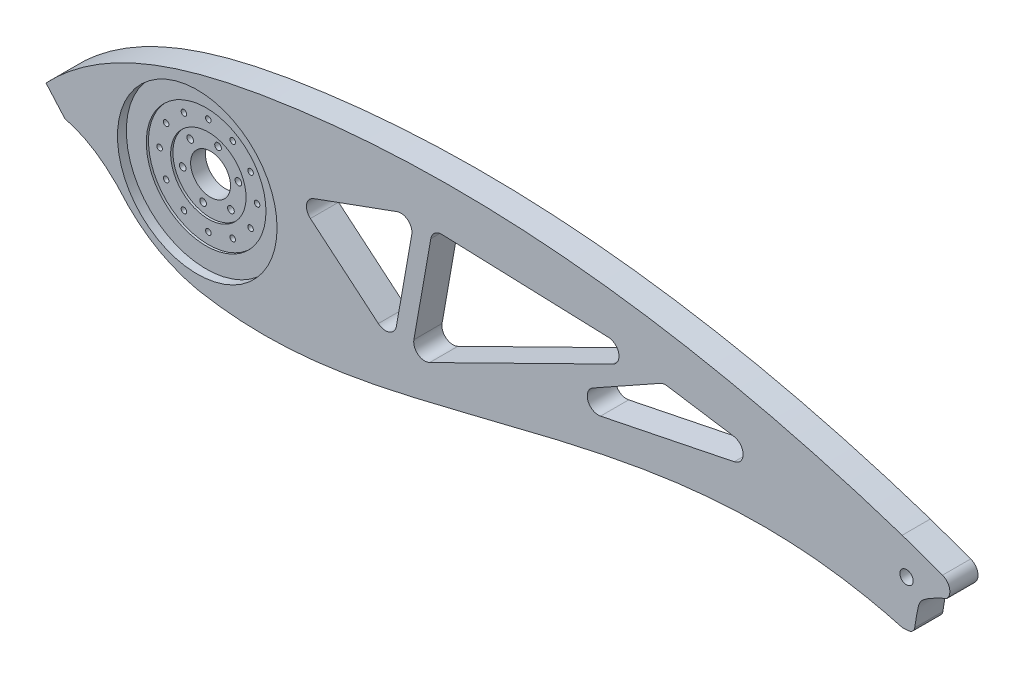
from build123d import *

# Parameters (mm, degrees)
SALIENTE_EXTRUIR1_DEPTH = 12.7
CORTAR_EXTRUIR20_DEPTH  = 62
CROQUIS12_R             = 26
CROQUIS12_R_2           = 17
CORTAR_EXTRUIR21_DEPTH  = 4
CROQUIS6_R              = 1.25
CORTAR_EXTRUIR22_DEPTH  = 29
CROQUIS13_R             = 1.5
CORTAR_EXTRUIR23_DEPTH  = 29
CROQUIS8_R              = 3
CORTAR_EXTRUIR27_DEPTH  = 64
CROQUIS5_R              = 36
CORTAR_EXTRUIR28_DEPTH  = 4
CROQUIS22_R             = 27
CORTAR_EXTRUIR32_DEPTH  = 1
CORTAR_EXTRUIR33_START  = -1
CROQUIS23_R             = 17
CORTAR_EXTRUIR33_DEPTH  = 1
CROQUIS24_R             = 9
CORTAR_EXTRUIR34_DEPTH  = 67


with BuildPart() as part:
    # Croquis2 → Saliente-Extruir1 (new body)
    with BuildSketch(Plane.XY):
        with BuildLine():
            add(Edge.make_bspline(
                [(318.003849686, 21.000507192), (228.612845689, 50.579171404), (93.837740705, 69.713331037), (-40.897656903, 33.469788637), (-68.237071347, 4.559111896)],
                knots=[0, 0, 0, 0, 0.7074371, 1, 1, 1, 1], degree=3))
            Line((-68.237071347, 4.559111896), (-59.653213383, -5.20395025))
            add(Edge.make_bspline(
                [(-31, -25), (-39.39631193, -15.138516418), (-48.385558495, -7.834552383), (-59.653213383, -5.20395025)],
                knots=[0.5325633, 0.5325633, 0.5325633, 0.5325633, 1, 1, 1, 1], degree=3))
            add(Edge.make_bspline(
                [(0, -42), (-18.317933693, -37.788499598), (-31, -25)],
                knots=[0, 0, 0, 0.892929879, 0.892929879, 0.892929879], degree=2))
            add(Edge.make_bspline(
                [(0, -42), (34.804106533, -48.583870116), (140.601557422, -28.662967351), (242.066250638, 5.979270436), (318.003849686, -15.054295763)],
                knots=[0, 0, 0, 0, 0.322299538, 1, 1, 1, 1], degree=3))
            ThreePointArc((318.003849686, -15.054295763), (319.540823222, -15.003980459), (321.071215203, -14.853250005))
            ThreePointArc((321.071215203, -14.853250005), (322.775428516, -14.025460634), (323.64375194, -12.341538815))
            add(Edge.make_bspline(
                [(338, 6.2), (337.96483394, 6.165565228), (334.391730923, 4.926696382), (325.456575586, -0.138969503), (325.231234185, -2.170240746), (323.64375194, -12.341538815)],
                knots=[0.205943753, 0.205943753, 0.205943753, 0.205943753, 0.210383616, 0.534400108, 0.959977028, 0.959977028, 0.959977028, 0.959977028], degree=3))
            ThreePointArc((338, 6.2), (339.38638351, 10.840617369), (336.189590247, 14.479010095))
            Line((336.189590247, 14.479010095), (318.003849686, 21.000507192))
        make_face()
    extrude(amount=SALIENTE_EXTRUIR1_DEPTH)

    # Croquis15 → Cortar-Extruir20 (cut)
    with BuildSketch(Plane.XY.offset(12.7)):
        with BuildLine():
            Line((97.723501447, -12.756776492), (105.361190757, 30.558712033))
            ThreePointArc((105.361190757, 30.558712033), (107.138627567, 33.576200952), (110.459727005, 34.68742528))
            Line((110.459727005, 34.68742528), (185.414039032, 32.069963027))
            ThreePointArc((185.414039032, 32.069963027), (190.128162759, 28.12247669), (187.449594034, 22.587959504))
            Line((187.449594034, 22.587959504), (104.857592698, -18.110066768))
            ThreePointArc((104.857592698, -18.110066768), (99.646563775, -17.624284866), (97.723501447, -12.756776492))
        make_face()
        with BuildLine():
            Line((89.822655638, -11.494535825), (96.768582744, 27.897774295))
            ThreePointArc((96.768582744, 27.897774295), (95.058482028, 32.596237399), (90.134443263, 33.464478287))
            Line((90.134443263, 33.464478287), (52.546738431, 19.783672554))
            ThreePointArc((52.546738431, 19.783672554), (49.332800383, 15.953450339), (51.0429011, 11.254987235))
            Line((51.0429011, 11.254987235), (81.684678824, -14.456517153))
            ThreePointArc((81.684678824, -14.456517153), (86.608717589, -15.324758041), (89.822655638, -11.494535825))
        make_face()
        with BuildLine():
            Line((178.485600868, 8.76169092), (208.786453861, 25.718640542))
            ThreePointArc((208.786453861, 25.718640542), (210.340015249, 26.275882173), (211.990356529, 26.296974372))
            Line((211.990356529, 26.296974372), (242.009853595, 21.667000055))
            ThreePointArc((242.009853595, 21.667000055), (246.246230456, 16.846807749), (242.248805987, 11.826674245))
            Line((242.248805987, 11.826674245), (181.928455927, -0.50030106))
            ThreePointArc((181.928455927, -0.50030106), (176.240671419, 2.65632611), (178.485600868, 8.76169092))
        make_face()
    extrude(amount=-CORTAR_EXTRUIR20_DEPTH, mode=Mode.SUBTRACT)

    # Croquis12 → Cortar-Extruir21 (cut)
    with BuildSketch(Plane(origin=(0, 0, 0), x_dir=(-1, 0, 0), z_dir=(0, 0, -1))):
        Circle(CROQUIS12_R)
        Circle(CROQUIS12_R_2, mode=Mode.SUBTRACT)
    extrude(amount=-CORTAR_EXTRUIR21_DEPTH, mode=Mode.SUBTRACT)

    # Croquis6 → Cortar-Extruir22 (cut)
    with BuildSketch(Plane.XY.offset(12.7)):
        with Locations((0, 22)):
            Circle(CROQUIS6_R)
        with Locations((11, 19.052558883)):
            Circle(CROQUIS6_R)
        with Locations((19.052558883, 11)):
            Circle(CROQUIS6_R)
        with Locations((22, 0)):
            Circle(CROQUIS6_R)
        with Locations((19.052558883, -11)):
            Circle(CROQUIS6_R)
        with Locations((11, -19.052558883)):
            Circle(CROQUIS6_R)
        with Locations((0, -22)):
            Circle(CROQUIS6_R)
        with Locations((-11, -19.052558883)):
            Circle(CROQUIS6_R)
        with Locations((-19.052558883, -11)):
            Circle(CROQUIS6_R)
        with Locations((-22, 0)):
            Circle(CROQUIS6_R)
        with Locations((-19.052558883, 11)):
            Circle(CROQUIS6_R)
        with Locations((-11, 19.052558883)):
            Circle(CROQUIS6_R)
    extrude(amount=-CORTAR_EXTRUIR22_DEPTH, mode=Mode.SUBTRACT)

    # Croquis13 → Cortar-Extruir23 (cut)
    with BuildSketch(Plane(origin=(0, 0, 0), x_dir=(-1, 0, 0), z_dir=(0, 0, -1))):
        with Locations((12.557035742, -3.364647586)):
            Circle(CROQUIS13_R)
        with Locations((3.364647586, -12.557035742)):
            Circle(CROQUIS13_R)
        with Locations((-9.192388155, -9.192388155)):
            Circle(CROQUIS13_R)
        with Locations((9.192388155, 9.192388155)):
            Circle(CROQUIS13_R)
        with Locations((-12.557035742, 3.364647586)):
            Circle(CROQUIS13_R)
        with Locations((-3.364647586, 12.557035742)):
            Circle(CROQUIS13_R)
    extrude(amount=-CORTAR_EXTRUIR23_DEPTH, mode=Mode.SUBTRACT)

    # Croquis8 → Cortar-Extruir27 (cut)
    with BuildSketch(Plane.XY.offset(12.7)):
        with Locations((319.95126245, 5.58477006)):
            Circle(CROQUIS8_R)
    extrude(amount=-CORTAR_EXTRUIR27_DEPTH, mode=Mode.SUBTRACT)

    # Croquis5 → Cortar-Extruir28 (cut)
    with BuildSketch(Plane.XY.offset(12.7)):
        Circle(CROQUIS5_R)
    extrude(amount=-CORTAR_EXTRUIR28_DEPTH, mode=Mode.SUBTRACT)

    # Croquis22 → Cortar-Extruir32 (cut)
    with BuildSketch(Plane.XY.offset(8.7)):
        Circle(CROQUIS22_R)
    extrude(amount=-CORTAR_EXTRUIR32_DEPTH, mode=Mode.SUBTRACT)

    # Croquis23 → Cortar-Extruir33 (cut)
    with BuildSketch(Plane.XY.offset(7.7).offset(CORTAR_EXTRUIR33_START)):
        with Locations(Location((0, 0, 0), (0, 0, 180))):
            Circle(CROQUIS23_R)
    extrude(amount=CORTAR_EXTRUIR33_DEPTH, mode=Mode.SUBTRACT)

    # Croquis24 → Cortar-Extruir34 (cut)
    with BuildSketch(Plane(origin=(0, 0, 0), x_dir=(-1, 0, 0), z_dir=(0, 0, -1))):
        Circle(CROQUIS24_R)
    extrude(amount=-CORTAR_EXTRUIR34_DEPTH, mode=Mode.SUBTRACT)


solid = part.part
